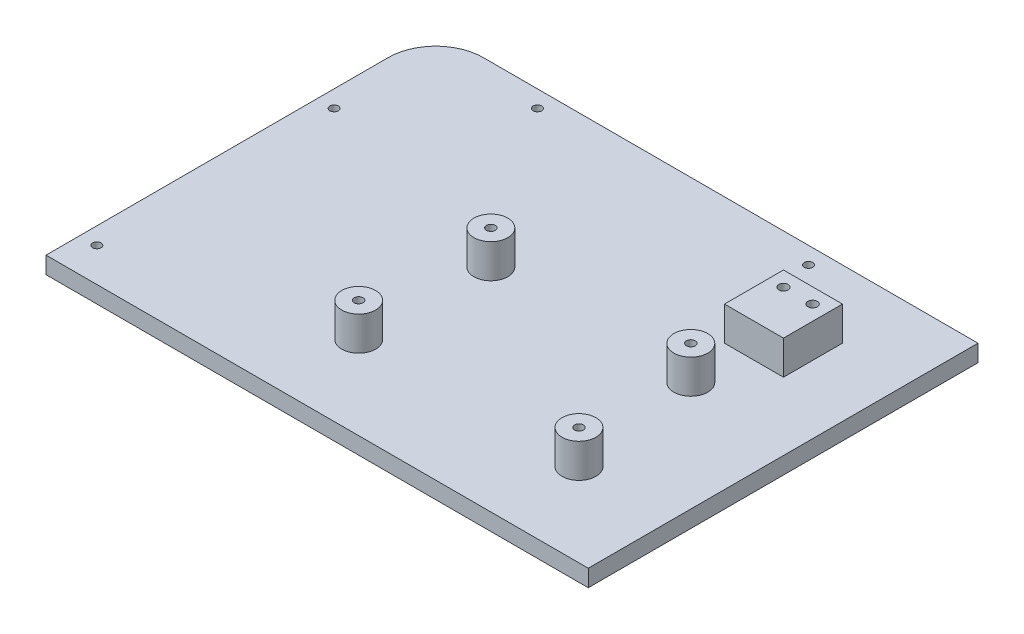
from build123d import *

# Parameters (mm, degrees)
SKETCH1_R           = 1.5875
BOSS_EXTRUDE1_DEPTH = 6.35
SKETCH2_W           = 22.098
SKETCH2_H           = 22.098
SKETCH2_R           = 1.778
BOSS_EXTRUDE2_DEPTH = 12.7
SKETCH3_R           = 6.35
BOSS_EXTRUDE3_DEPTH = 12.7
SKETCH5_R           = 1.651
CUT_EXTRUDE1_DEPTH  = 251.965625136


with BuildPart() as part:
    # Sketch1 → Boss-Extrude1 (new body)
    with BuildSketch(Plane(origin=(0, 0, 0), x_dir=(1, 0, 0), z_dir=(0, 1, 0))):
        with BuildLine():
            Line((0, 0), (203.2, 0))
            Line((203.2, 0), (203.2, 146.05))
            Line((203.2, 146.05), (17.78, 146.05))
            ThreePointArc((17.78, 146.05), (5.207641431, 140.842358569), (0, 128.27))
            Line((0, 128.27), (0, 0))
        make_face()
        with Locations(Location((6.35, 12.7, 0), (0, 0, 270))):
            Circle(SKETCH1_R, mode=Mode.SUBTRACT)
        with Locations(Location((6.35, 101.6, 0), (0, 0, 270))):
            Circle(SKETCH1_R, mode=Mode.SUBTRACT)
        with Locations(Location((44.45, 139.7, 0), (0, 0, 270))):
            Circle(SKETCH1_R, mode=Mode.SUBTRACT)
        with Locations(Location((146.05, 139.7, 0), (0, 0, 270))):
            Circle(SKETCH1_R, mode=Mode.SUBTRACT)
    extrude(amount=BOSS_EXTRUDE1_DEPTH)

    # Sketch2 → Boss-Extrude2 (add)
    with BuildSketch(Plane(origin=(0, 6.35, 0), x_dir=(1, 0, 0), z_dir=(0, 1, 0))):
        with Locations((166.751, 109.601)):
            Rectangle(SKETCH2_W, SKETCH2_H)
        with Locations(Location((172.212, 115.062, 0), (0, 0, 270))):
            Circle(SKETCH2_R, mode=Mode.SUBTRACT)
        with Locations(Location((161.29, 115.062, 0), (0, 0, 270))):
            Circle(SKETCH2_R, mode=Mode.SUBTRACT)
    extrude(amount=BOSS_EXTRUDE2_DEPTH)

    # Sketch3 → Boss-Extrude3 (add)
    with BuildSketch(Plane(origin=(0, 6.35, 0), x_dir=(1, 0, 0), z_dir=(0, 1, 0))):
        with Locations(Location((162.13368637, 79.502, 0), (0, 0, 270))):
            Circle(SKETCH3_R)
        with Locations(Location((168.48368637, 31.242, 0), (0, 0, 270))):
            Circle(SKETCH3_R)
        with Locations(Location((87.20368637, 79.502, 0), (0, 0, 270))):
            Circle(SKETCH3_R)
        with Locations(Location((85.93368637, 31.242, 0), (0, 0, 270))):
            Circle(SKETCH3_R)
    extrude(amount=BOSS_EXTRUDE3_DEPTH)

    # Sketch5 → Cut-Extrude1 (cut, through all)
    with BuildSketch(Plane(origin=(0, 19.05, 0), x_dir=(1, 0, 0), z_dir=(0, 1, 0))):
        with Locations(Location((168.48368637, 31.242, 0), (0, 0, 270))):
            Circle(SKETCH5_R)
        with Locations(Location((162.13368637, 79.502, 0), (0, 0, 270))):
            Circle(SKETCH5_R)
        with Locations(Location((87.20368637, 79.502, 0), (0, 0, 270))):
            Circle(SKETCH5_R)
        with Locations(Location((85.93368637, 31.242, 0), (0, 0, 270))):
            Circle(SKETCH5_R)
    extrude(amount=-CUT_EXTRUDE1_DEPTH, mode=Mode.SUBTRACT)


solid = part.part
